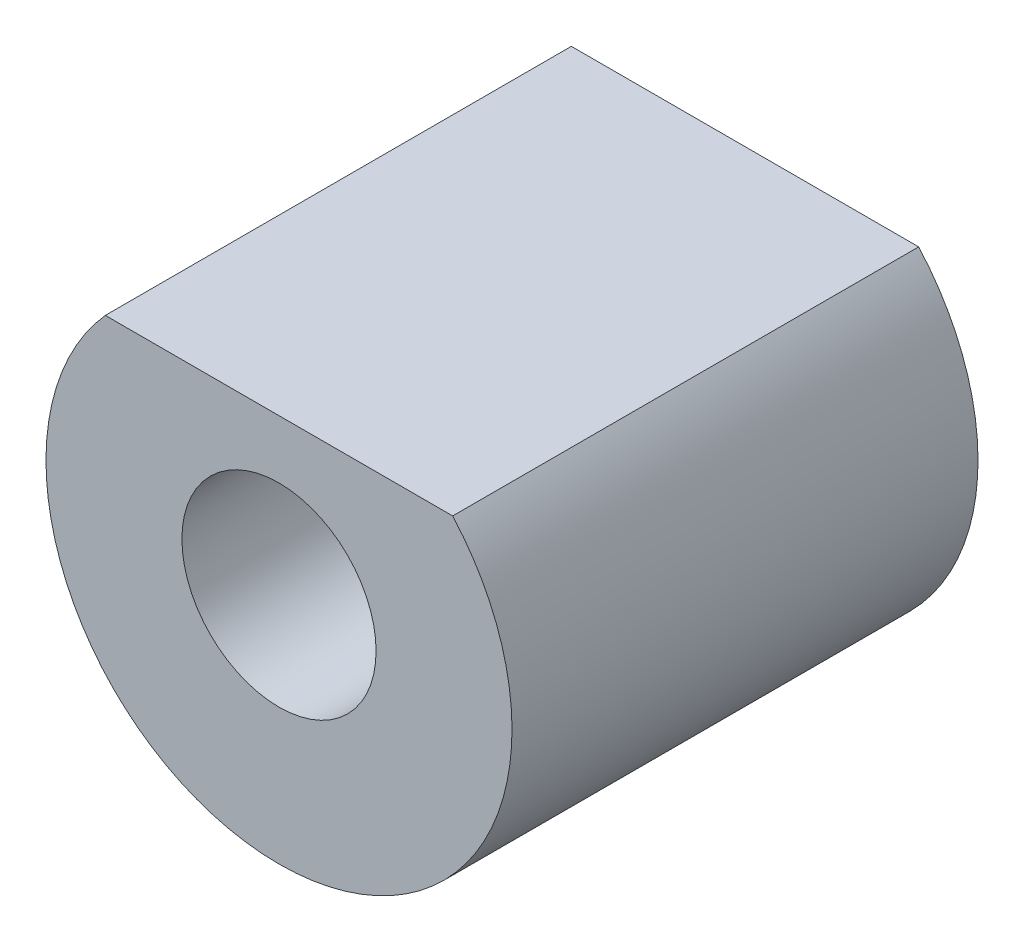
from build123d import *

# Parameters (mm, degrees)
SKETCH1_R           = 1.25
BOSS_EXTRUDE1_DEPTH = 6


with BuildPart() as part:
    # Sketch1 → Boss-Extrude1 (new body)
    with BuildSketch(Plane.XY):
        with BuildLine():
            Line((-2.236067977, 2), (2.236067977, 2))
            ThreePointArc((2.236067977, 2), (0, -3), (-2.236067977, 2))
        make_face()
        Circle(SKETCH1_R, mode=Mode.SUBTRACT)
    extrude(amount=BOSS_EXTRUDE1_DEPTH)


solid = part.part
